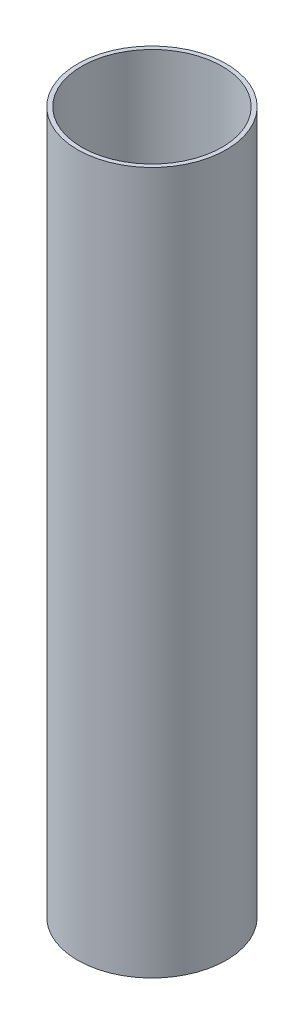
from build123d import *

# Parameters (mm, degrees)
SKETCH1_R           = 53
SKETCH1_R_2         = 50
BOSS_EXTRUDE1_DEPTH = 500


with BuildPart() as part:
    # Sketch1 → Boss-Extrude1 (new body)
    with BuildSketch(Plane(origin=(0, 0, 0), x_dir=(1, 0, 0), z_dir=(0, 1, 0))):
        with Locations(Location((0, 0, 0), (0, 0, 270))):
            Circle(SKETCH1_R)
        with Locations(Location((0, 0, 0), (0, 0, 270))):
            Circle(SKETCH1_R_2, mode=Mode.SUBTRACT)
    extrude(amount=BOSS_EXTRUDE1_DEPTH)


solid = part.part
